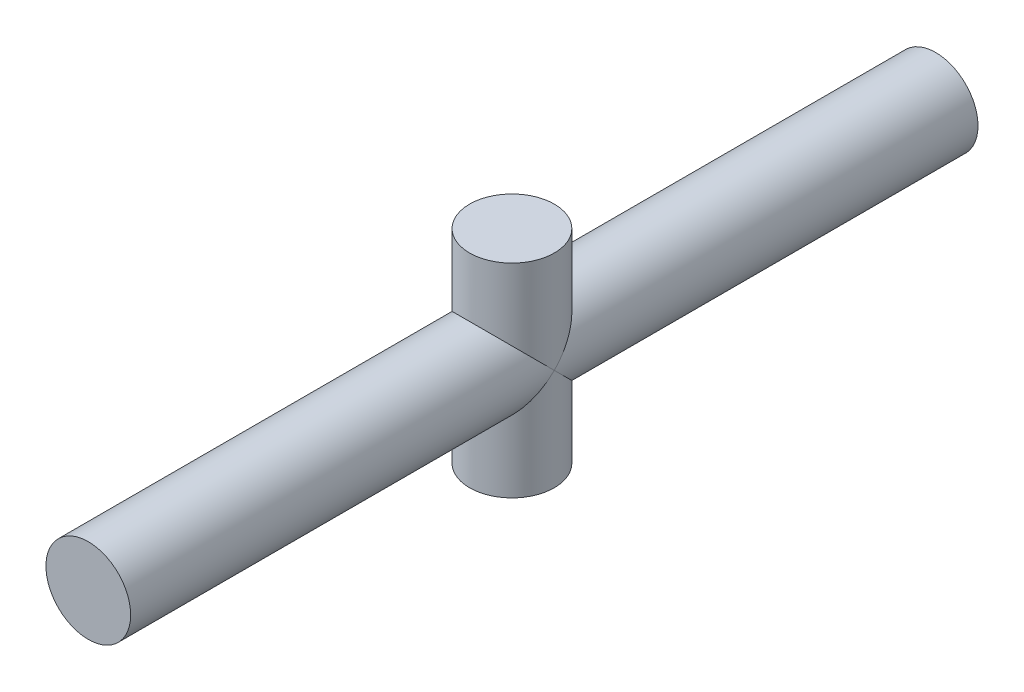
from build123d import *

# Parameters (mm, degrees)
SKETCH1_R           = 2.5
BOSS_EXTRUDE1_DEPTH = 12
SKETCH2_R           = 2.5
BOSS_EXTRUDE2_DEPTH = 25


with BuildPart() as part:
    # Sketch1 → Boss-Extrude1 (new body)
    with BuildSketch(Plane(origin=(0, 0, 0), x_dir=(1, 0, 0), z_dir=(0, 1, 0))):
        with Locations(Location((0, 0, 0), (0, 0, 270))):
            Circle(SKETCH1_R)
    extrude(amount=BOSS_EXTRUDE1_DEPTH)

    # Sketch2 → Boss-Extrude2 (add, symmetric)
    with BuildSketch(Plane.XY):
        with Locations((0, 6)):
            Circle(SKETCH2_R)
    extrude(amount=BOSS_EXTRUDE2_DEPTH, both=True)


solid = part.part
